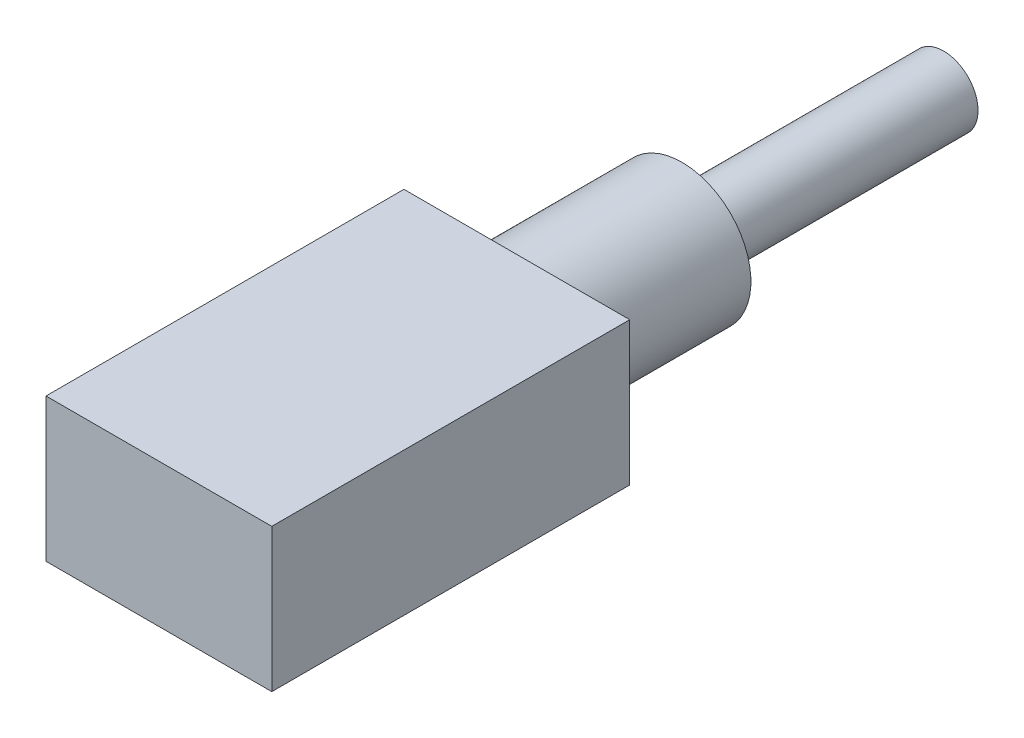
from build123d import *

# Parameters (mm, degrees)
SKETCH_1_W      = 8.2
SKETCH_1_H      = 5.2
EXTRUDE_1_DEPTH = 13
SKETCH_2_R      = 2.5
EXTRUDE_2_DEPTH = 6
SKETCH_3_R      = 1.25
EXTRUDE_3_DEPTH = 9.5


with BuildPart() as part:
    # 草圖1 → 填料-伸長1 (new body)
    with BuildSketch(Plane.XY):
        with Locations((-38.465519845, -46.707444045)):
            Rectangle(SKETCH_1_W, SKETCH_1_H)
    extrude(amount=EXTRUDE_1_DEPTH)

    # 草圖2 → 填料-伸長2 (add)
    with BuildSketch(Plane(origin=(0, 0, 0), x_dir=(-1, 0, 0), z_dir=(0, 0, -1))):
        with Locations((38.465519845, -46.707444045)):
            Circle(SKETCH_2_R)
    extrude(amount=EXTRUDE_2_DEPTH)

    # 草圖3 → 填料-伸長3 (add)
    with BuildSketch(Plane(origin=(0, 0, -6), x_dir=(-1, 0, 0), z_dir=(0, 0, -1))):
        with Locations((38.465519845, -46.707444045)):
            Circle(SKETCH_3_R)
    extrude(amount=EXTRUDE_3_DEPTH)


solid = part.part
